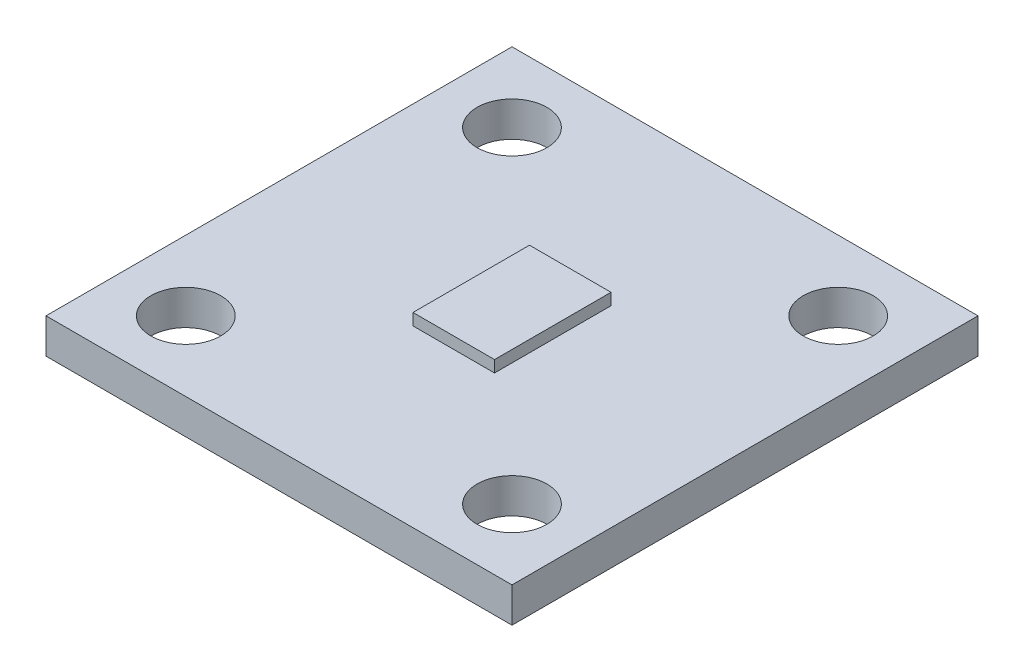
from build123d import *

# Parameters (mm, degrees)
SKETCH_1_W      = 20
SKETCH_1_H      = 20
SKETCH_1_R      = 1.5
EXTRUDE_1_DEPTH = 1.5
SKETCH_2_W      = 3.5
SKETCH_2_H      = 5
EXTRUDE_2_DEPTH = 0.5


with BuildPart() as part:
    # 草图1 → 凸台-拉伸1 (new body)
    with BuildSketch(Plane(origin=(0, 0, 0), x_dir=(1, 0, 0), z_dir=(0, 1, 0))):
        with Locations((10, 10)):
            Rectangle(SKETCH_1_W, SKETCH_1_H)
        with Locations(Location((3, 17, 0), (0, 0, 270))):
            Circle(SKETCH_1_R, mode=Mode.SUBTRACT)
        with Locations(Location((17, 17, 0), (0, 0, 90))):
            Circle(SKETCH_1_R, mode=Mode.SUBTRACT)
        with Locations(Location((17, 3, 0), (0, 0, 270))):
            Circle(SKETCH_1_R, mode=Mode.SUBTRACT)
        with Locations(Location((3, 3, 0), (0, 0, 90))):
            Circle(SKETCH_1_R, mode=Mode.SUBTRACT)
    extrude(amount=EXTRUDE_1_DEPTH)

    # 草图2 → 凸台-拉伸2 (add)
    with BuildSketch(Plane(origin=(0, 1.5, 0), x_dir=(1, 0, 0), z_dir=(0, 1, 0))):
        with Locations((10, 10)):
            Rectangle(SKETCH_2_W, SKETCH_2_H)
    extrude(amount=EXTRUDE_2_DEPTH)


solid = part.part
